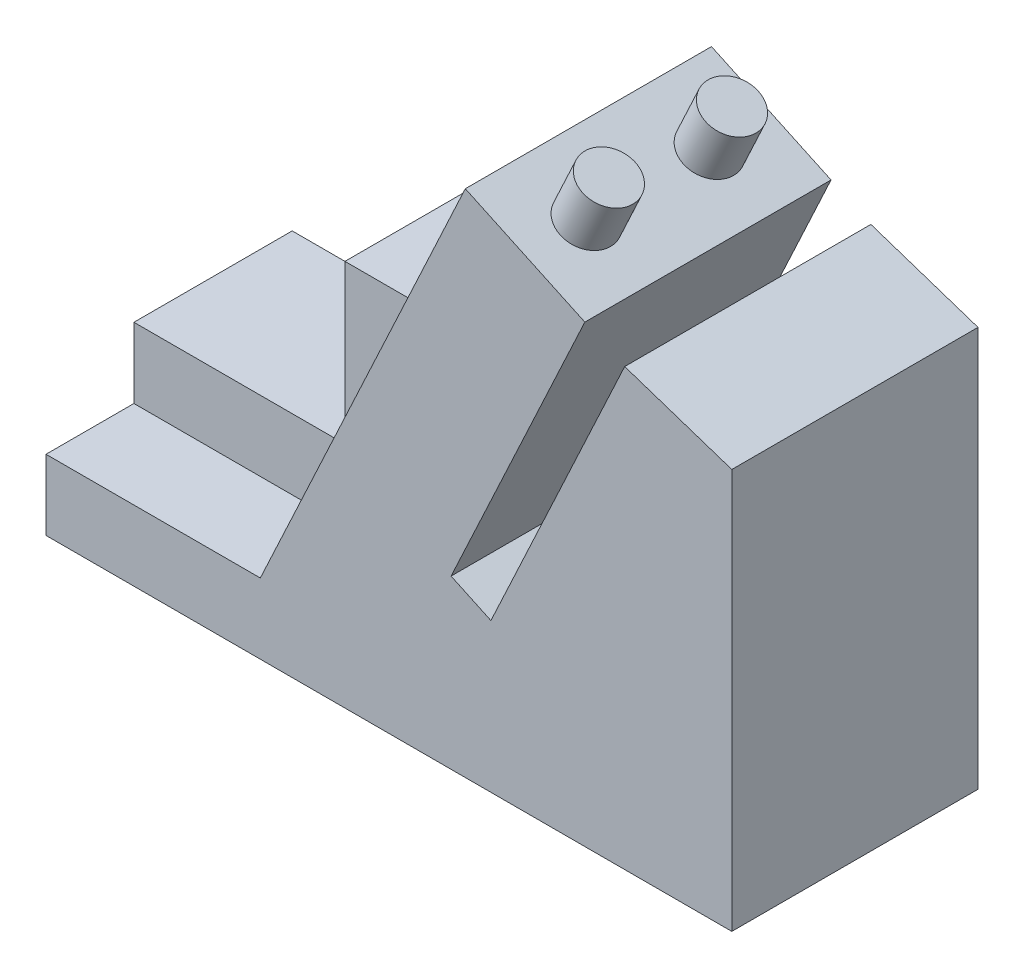
from build123d import *

# Parameters (mm, degrees)
BOSS_EXTRUDE1_DEPTH = 28
BOSS_EXTRUDE2_DEPTH = 18
SKETCH4_R           = 3
BOSS_EXTRUDE3_DEPTH = 6


with BuildPart() as part:
    # Sketch1 → Boss-Extrude1 (new body)
    with BuildSketch(Plane.XY):
        Polygon((-78, 0), (0, 0), (0, 45.5), (-12.183101538, 49.547634765), (-27.397358961, 16.920554432), (-31.928897896, 19.033645741), (-16.714640473, 51.660726074), (-30.309257279, 58), (-41.500641075, 34), (-53.624640187, 8), (-78, 8), align=None)
    extrude(amount=BOSS_EXTRUDE1_DEPTH)

    # Sketch1<4> → Boss-Extrude2 (add)
    with BuildSketch(Plane.XY):
        Polygon((-78, 16), (-78, 8), (-53.624640187, 8), (-41.500641075, 34), (-54, 34), (-54, 16), align=None)
    extrude(amount=BOSS_EXTRUDE2_DEPTH)

    # Sketch4 → Boss-Extrude3 (add)
    with BuildSketch(Plane(origin=(16.80186773, 36.031721624, 0), x_dir=(0.9063077870366462, -0.4226182617407076, 0), z_dir=(0.4226182617407076, 0.9063077870366462, 0))):
        with Locations((-44.481375072, -21)):
            Circle(SKETCH4_R)
        with Locations((-44.481375072, -7)):
            Circle(SKETCH4_R)
    extrude(amount=BOSS_EXTRUDE3_DEPTH)


solid = part.part
